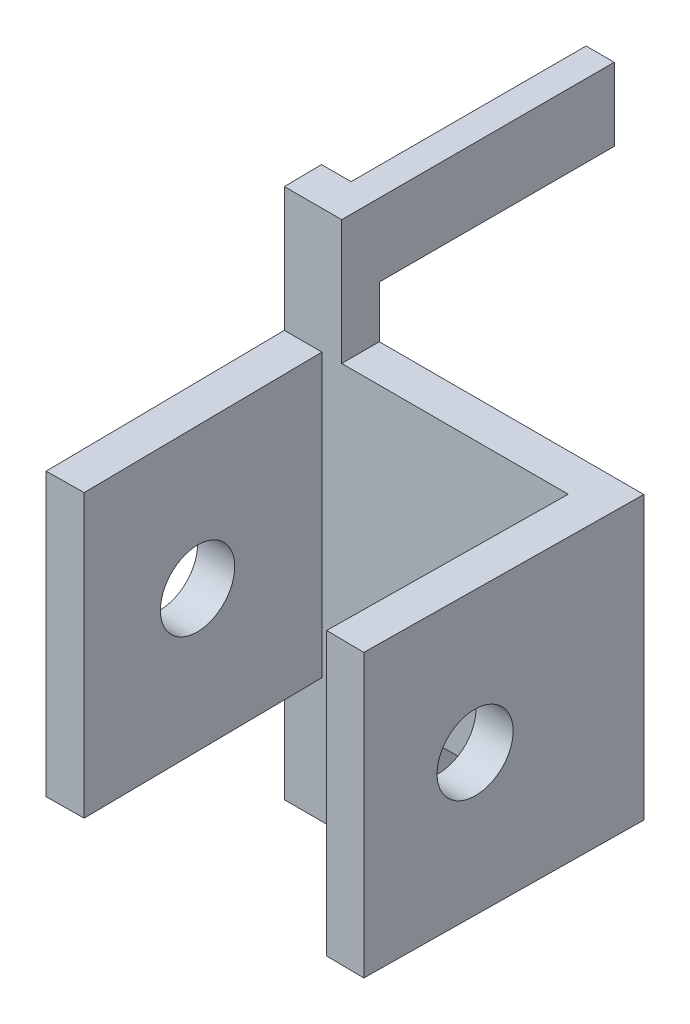
from build123d import *

# Parameters (mm, degrees)
BOSS_EXTRUDE1_DEPTH      = 30
SKETCH3_R                = 4
CUT_EXTRUDE1_DEPTH       = 40
SKETCH4_W                = 3
SKETCH4_H                = 41
BOSS_EXTRUDE2_DEPTH      = 4
BOSS_EXTRUDE3_DEPTH      = 25
BOSS_EXTRUDE3_DEPTH_BACK = 4
SKETCH5_W                = 3
SKETCH5_H                = 7.75
BOSS_EXTRUDE4_REACH      = 69.734
SKETCH6_W                = 4
SKETCH6_H                = 56.5


with BuildPart() as part:
    # Sketch1 → Boss-Extrude1 (new body)
    with BuildSketch(Plane(origin=(0, 0, 0), x_dir=(1, 0, 0), z_dir=(0, 1, 0))):
        Polygon((-12.8, -12.8), (-13.1, 12.8), (13.1, 12.8), (12.8, -12.6), (16.799721029, -12.6472408), (17.147523085, 16.8), (-17.147149649, 16.8), (-16.79972537, -12.846871782), align=None)
    extrude(amount=BOSS_EXTRUDE1_DEPTH)

    # Sketch3 → Cut-Extrude1 (cut)
    with BuildSketch(Plane(origin=(16.946733814, 0, 0.200158273), x_dir=(0.011810199887684227, 0, -0.9999302571572745), z_dir=(0.9999302571572745, 0, 0.011810199887684227))):
        with Locations(Location((-0.747950682, 15, 0), (0, 0, 180))):
            Circle(SKETCH3_R)
    extrude(amount=-CUT_EXTRUDE1_DEPTH, mode=Mode.SUBTRACT)

    # Sketch4 → Boss-Extrude2 (add)
    with BuildSketch(Plane(origin=(0, 0, -16.8), x_dir=(-1, 0, 0), z_dir=(0, 0, -1))):
        with Locations((12.499813282, 15)):
            Rectangle(SKETCH4_W, SKETCH4_H)
    extrude(amount=-BOSS_EXTRUDE2_DEPTH)

    # Sketch5 → Boss-Extrude3 (add, two sides: drawn at the far end of the back side and taken through both)
    with BuildSketch(Plane(origin=(0, 0, -16.8), x_dir=(-1, 0, 0), z_dir=(0, 0, -1)).offset(-BOSS_EXTRUDE3_DEPTH_BACK)):
        with Locations((12.499813282, 39.375)):
            Rectangle(SKETCH5_W, SKETCH5_H)
        with Locations((12.499813282, -9.375)):
            Rectangle(SKETCH5_W, SKETCH5_H)
    extrude(amount=BOSS_EXTRUDE3_DEPTH + BOSS_EXTRUDE3_DEPTH_BACK)

    # Boss-Extrude4: up to this plane
    boss_extrude4_end = Plane(origin=(-16.79972537, 30, 12.846871782), z_dir=(0.9999313425206403, 0, -0.01171794542016394))
    # Sketch6 → Boss-Extrude4 (add, up to the surface)
    with BuildSketch(Plane.ZY.offset(13.999813282), mode=Mode.PRIVATE) as boss_extrude4_sk1:
        with Locations((-14.8, 15)):
            Rectangle(SKETCH6_W, SKETCH6_H)
    boss_extrude4_tool1 = split(extrude(boss_extrude4_sk1.sketch, amount=BOSS_EXTRUDE4_REACH, mode=Mode.PRIVATE), bisect_by=boss_extrude4_end, keep=Keep.BOTH, mode=Mode.PRIVATE)
    add(boss_extrude4_tool1.solids().sort_by_distance((-13.999813, 15, -14.8))[0])


solid = part.part
